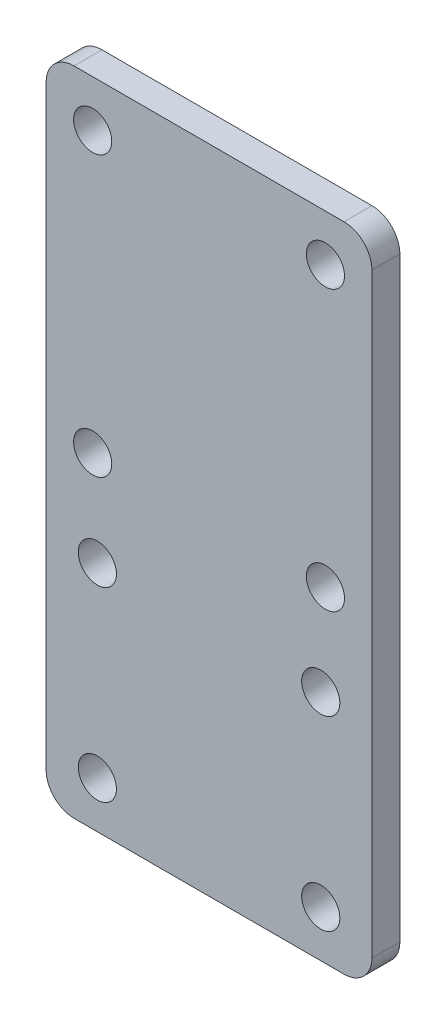
from build123d import *

# Parameters (mm, degrees)
SKETCH_1_W      = 35
SKETCH_1_H      = 70
SKETCH_1_R      = 2.05
EXTRUDE_1_DEPTH = 3
FILLET_1_R      = 3


with BuildPart() as part:
    # 草图1 → 凸台-拉伸1 (new body)
    with BuildSketch(Plane.XY):
        Rectangle(SKETCH_1_W, SKETCH_1_H)
        with Locations((-12.5, 30)):
            Circle(SKETCH_1_R, mode=Mode.SUBTRACT)
        with Locations((-12.5, 0)):
            Circle(SKETCH_1_R, mode=Mode.SUBTRACT)
        with Locations((12.5, 0)):
            Circle(SKETCH_1_R, mode=Mode.SUBTRACT)
        with Locations((12.5, 30)):
            Circle(SKETCH_1_R, mode=Mode.SUBTRACT)
        with Locations((-12, -10)):
            Circle(SKETCH_1_R, mode=Mode.SUBTRACT)
        with Locations((-12, -30)):
            Circle(SKETCH_1_R, mode=Mode.SUBTRACT)
        with Locations((12, -30)):
            Circle(SKETCH_1_R, mode=Mode.SUBTRACT)
        with Locations((12, -10)):
            Circle(SKETCH_1_R, mode=Mode.SUBTRACT)
    extrude(amount=EXTRUDE_1_DEPTH)

    # 圆角1
    fillet_1_edges = [part.edges().sort_by_distance(p)[0] for p in [
        (17.5, -35, 1.5),
        (-17.5, -35, 1.5),
        (-17.5, 35, 1.5),
        (17.5, 35, 1.5),
    ]]
    fillet(fillet_1_edges, radius=FILLET_1_R)


solid = part.part
